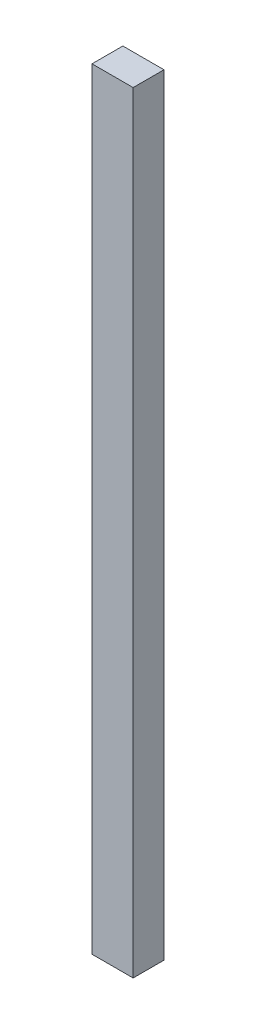
from build123d import *

# Parameters (mm, degrees)
ESQUISSE1_W        = 40
ESQUISSE1_H        = 750
BOSS_EXTRU_1_DEPTH = 30


with BuildPart() as part:
    # Esquisse1 → Boss.-Extru.1 (new body)
    with BuildSketch(Plane.XY):
        with Locations((20, -375)):
            Rectangle(ESQUISSE1_W, ESQUISSE1_H)
    extrude(amount=BOSS_EXTRU_1_DEPTH)


solid = part.part
